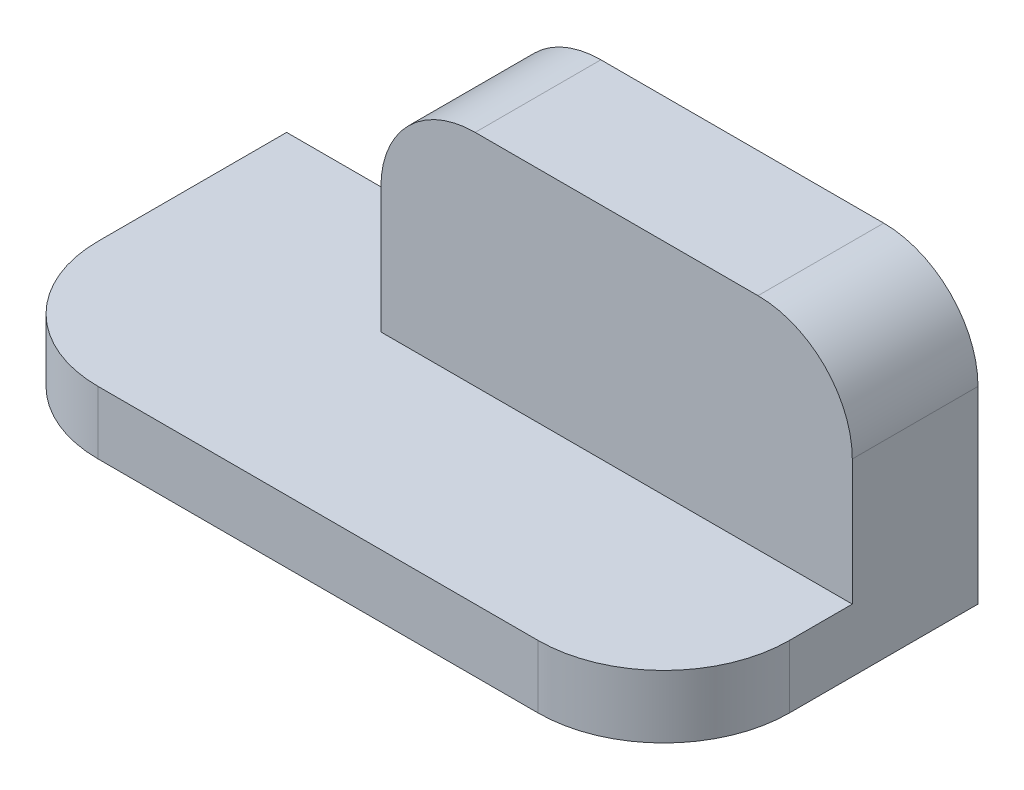
from build123d import *

# Parameters (mm, degrees)
SKETCH1_W           = 110
SKETCH1_H           = 50
BOSS_EXTRUDE1_DEPTH = 10
SKETCH2_W           = 75
SKETCH2_H           = 20
BOSS_EXTRUDE2_DEPTH = 35
FILLET2_R           = 15
FILLET3_R           = 20


with BuildPart() as part:
    # Sketch1 → Boss-Extrude1 (new body)
    with BuildSketch(Plane(origin=(0, 0, 0), x_dir=(1, 0, 0), z_dir=(0, 1, 0))):
        with Locations((55, 25)):
            Rectangle(SKETCH1_W, SKETCH1_H)
    extrude(amount=BOSS_EXTRUDE1_DEPTH)

    # Sketch2 → Boss-Extrude2 (add)
    with BuildSketch(Plane(origin=(0, 10, 0), x_dir=(1, 0, 0), z_dir=(0, 1, 0))):
        with Locations((72.5, 40)):
            Rectangle(SKETCH2_W, SKETCH2_H)
    extrude(amount=BOSS_EXTRUDE2_DEPTH)

    # Fillet2
    fillet2_edges = [part.edges().sort_by_distance(p)[0] for p in [
        (110, 45, -40),
        (35, 45, -40),
    ]]
    fillet(fillet2_edges, radius=FILLET2_R)

    # Fillet3
    fillet3_edges = [part.edges().sort_by_distance(p)[0] for p in [
        (110, 5, 0),
        (0, 5, 0),
    ]]
    fillet(fillet3_edges, radius=FILLET3_R)


solid = part.part
